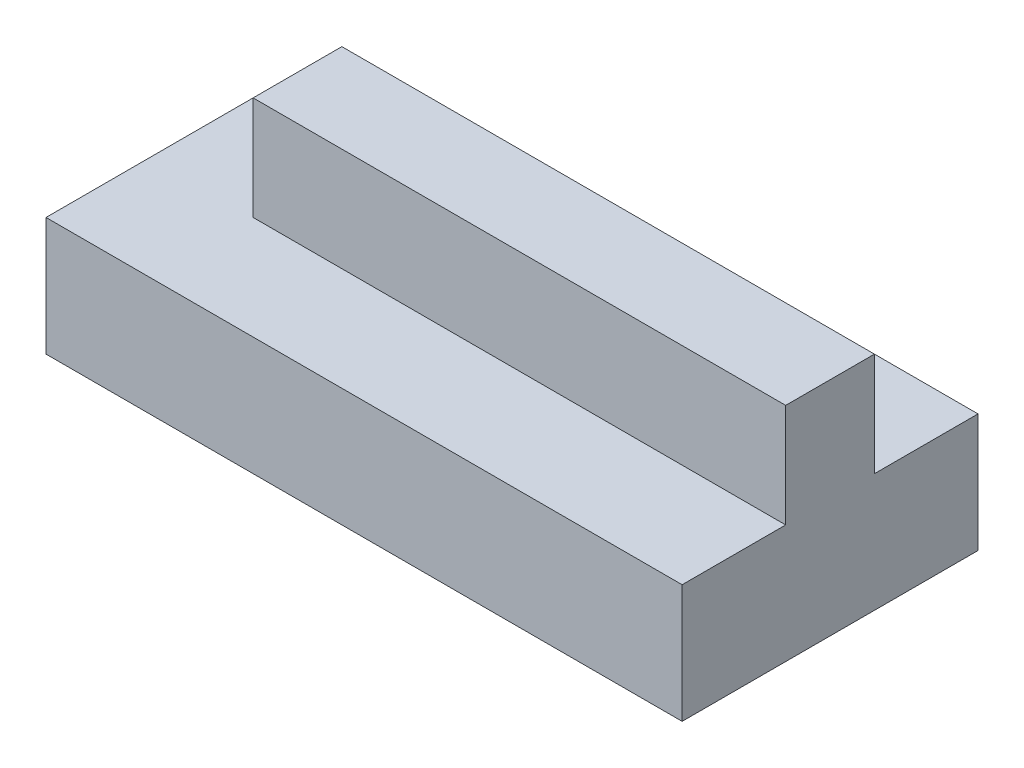
from build123d import *

# Parameters (mm, degrees)
SKETCH1_W           = 21.5
SKETCH1_H           = 10
BOSS_EXTRUDE1_DEPTH = 4
SKETCH2_W           = 18
SKETCH2_H           = 3
BOSS_EXTRUDE2_DEPTH = 3.5


with BuildPart() as part:
    # Sketch1 → Boss-Extrude1 (new body)
    with BuildSketch(Plane(origin=(0, 0, 0), x_dir=(1, 0, 0), z_dir=(0, 1, 0))):
        with Locations((10.75, 5)):
            Rectangle(SKETCH1_W, SKETCH1_H)
    extrude(amount=BOSS_EXTRUDE1_DEPTH)

    # Sketch2 → Boss-Extrude2 (add)
    with BuildSketch(Plane(origin=(0, 4, 0), x_dir=(1, 0, 0), z_dir=(0, 1, 0))):
        with Locations((12.5, 5)):
            Rectangle(SKETCH2_W, SKETCH2_H)
    extrude(amount=BOSS_EXTRUDE2_DEPTH)


solid = part.part
